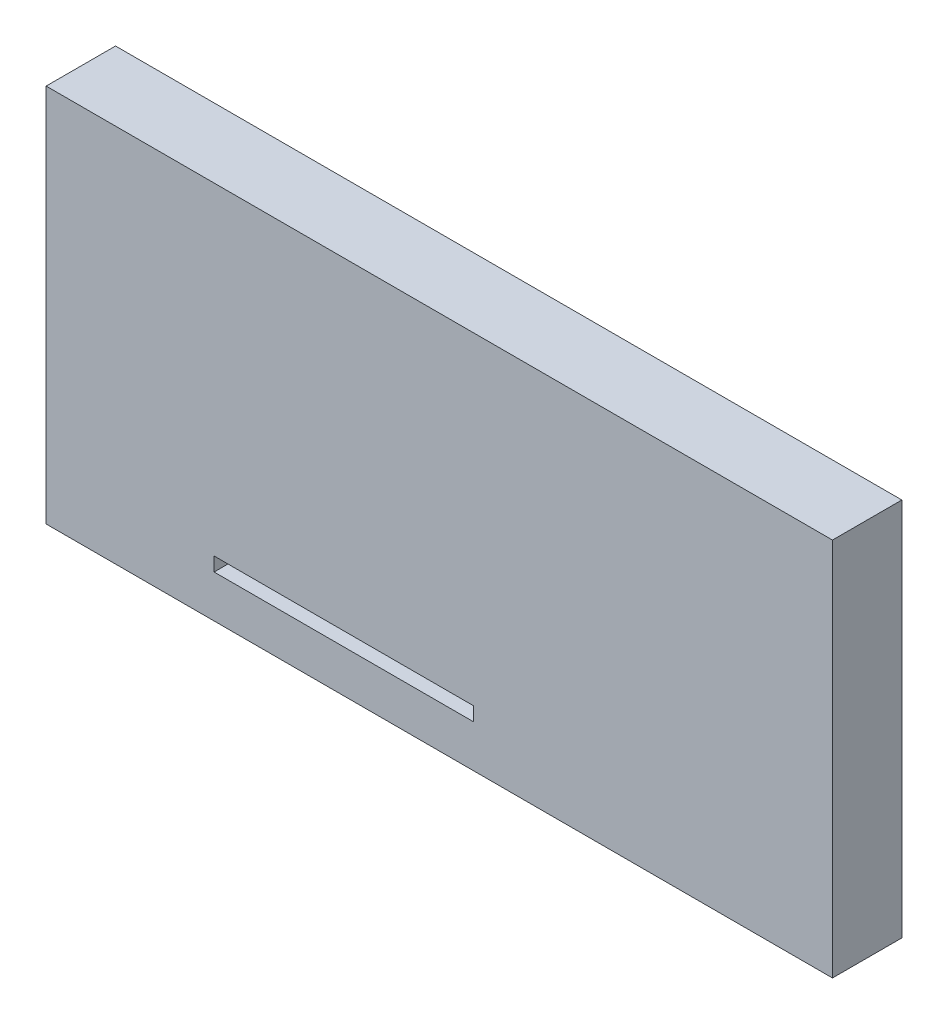
from build123d import *

# Parameters (mm, degrees)
SKETCH2_W           = 170
SKETCH2_H           = 82
BOSS_EXTRUDE1_DEPTH = 15
SKETCH6_R           = 2
SKETCH7_W           = 56.062084811
SKETCH7_H           = 3
CUT_EXTRUDE2_DEPTH  = 96.636028792
LPATTERN1_COUNT     = 2
LPATTERN1_PITCH     = 10


with BuildPart() as part:
    # Sketch2 → Boss-Extrude1 (new body)
    with BuildSketch(Plane.XY):
        Rectangle(SKETCH2_W, SKETCH2_H)
    extrude(amount=BOSS_EXTRUDE1_DEPTH)

    # Sweep1: sweep along a path in Sketch5
    with BuildLine(Plane(origin=(0, 0, 0), x_dir=(0, 0, -1), z_dir=(1, 0, 0))) as sweep1_path:
        Line((0, 29.163871958), (5.5, 29.163871958))
        ThreePointArc((5.5, 29.163871958), (11.156854249, 26.820726208), (13.5, 21.163871958))
        Line((13.5, 21.163871958), (13.5, -15.836128042))
    # Sketch6 → Sweep1 (sweep)
    with BuildSketch(Plane(origin=(0, 0, 0), x_dir=(-1, 0, 0), z_dir=(0, 0, -1))):
        with Locations((0, 29.163871958)):
            Circle(SKETCH6_R)
    sweep1 = sweep(path=sweep1_path.line)

    # Sketch7 → Cut-Extrude2 (cut, through all)
    with BuildSketch(Plane(origin=(0, 0, 0), x_dir=(-1, 0, 0), z_dir=(0, 0, -1))):
        with Locations((20.655822978, -30.33067124)):
            Rectangle(SKETCH7_W, SKETCH7_H)
    extrude(amount=-CUT_EXTRUDE2_DEPTH, mode=Mode.SUBTRACT)

    # LPattern1: Sweep1 ×2
    with Locations(*[(-i * LPATTERN1_PITCH, 0, 0) for i in range(1, LPATTERN1_COUNT)]):
        add(sweep1)


solid = part.part
